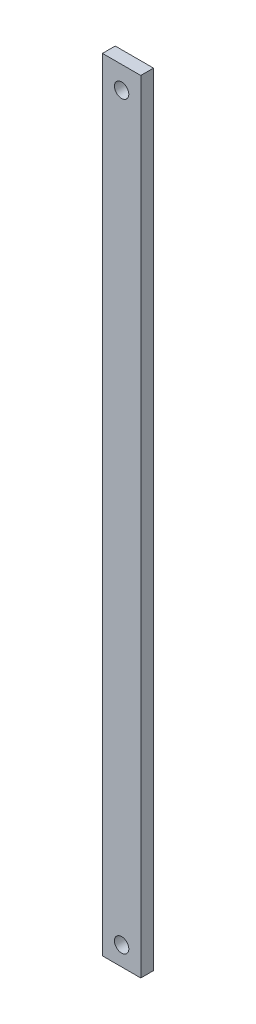
from build123d import *

# Parameters (mm, degrees)
SKETCH1_W                     = 12
SKETCH1_H                     = 245
PROFILE_DEPTH                 = 4
FASTENER_CLEARANCE_DEPTH      = 246.326313305
FASTENER_CLEARANCE_DEPTH_BACK = 246.326313305
SKETCH2_R                     = 2.25


with BuildPart() as part:
    # Sketch1 → Profile (new body)
    with BuildSketch(Plane.XY):
        with Locations((6, 122.5)):
            Rectangle(SKETCH1_W, SKETCH1_H)
    extrude(amount=PROFILE_DEPTH)

    # Sketch2 → Fastener_clearance (cut, two sides: drawn at the far end of the back side and taken through both)
    with BuildSketch(Plane.XY.offset(-FASTENER_CLEARANCE_DEPTH_BACK)):
        with Locations((6, 6)):
            Circle(SKETCH2_R)
        with Locations((6, 238)):
            Circle(SKETCH2_R)
    extrude(amount=FASTENER_CLEARANCE_DEPTH + FASTENER_CLEARANCE_DEPTH_BACK, mode=Mode.SUBTRACT)


solid = part.part
